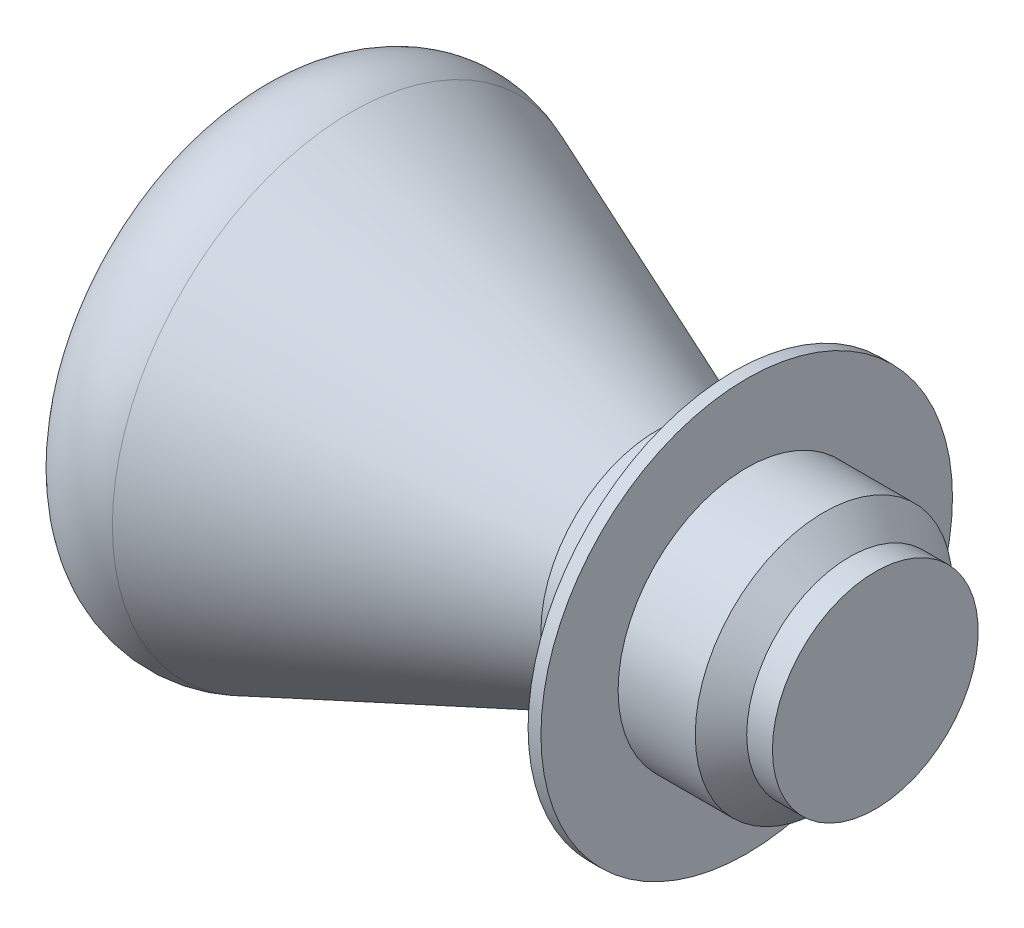
from build123d import *


with BuildPart() as part:
    # Sketch1 → Revolve1 (revolve)
    with BuildSketch(Plane.XY, mode=Mode.PRIVATE) as revolve1_sk:
        Polygon((0, 0), (5.5, 0), (5.5, 4), (4.5, 4), (3.5, 5), (0.5, 5), (0.5, 8), (0, 8), (0, 5), (-2, 5), (-2, 4.5), (0, 4.5), align=None)
    revolve(revolve1_sk.sketch.rotate(Axis((0, 0, 0), (1, 0, 0)), 90), axis=Axis((0, 0, 0), (1, 0, 0)))


with BuildPart() as body_2:
    # Sketch2 → Revolve2 (revolve)
    with BuildSketch(Plane.XY, mode=Mode.PRIVATE) as revolve2_sk:
        with BuildLine():
            Line((0, 0), (0, 4.5))
            Line((0, 4.5), (-3, 4.5))
            Line((-3, 4.5), (-14.879552076, 9.282911506))
            ThreePointArc((-14.879552076, 9.282911506), (-17.33908982, 9.184555541), (-18.897122568, 7.278897186))
            ThreePointArc((-18.897122568, 7.278897186), (-19.617135765, 3.671057081), (-19.858525772, 0))
            Line((-19.858525772, 0), (0, 0))
        make_face()
    revolve(revolve2_sk.sketch.rotate(Axis((-19.858525772, 0, 0), (1, 0, 0)), 90), axis=Axis((-19.858525772, 0, 0), (1, 0, 0)))


solid = Compound([part.part, body_2.part])
